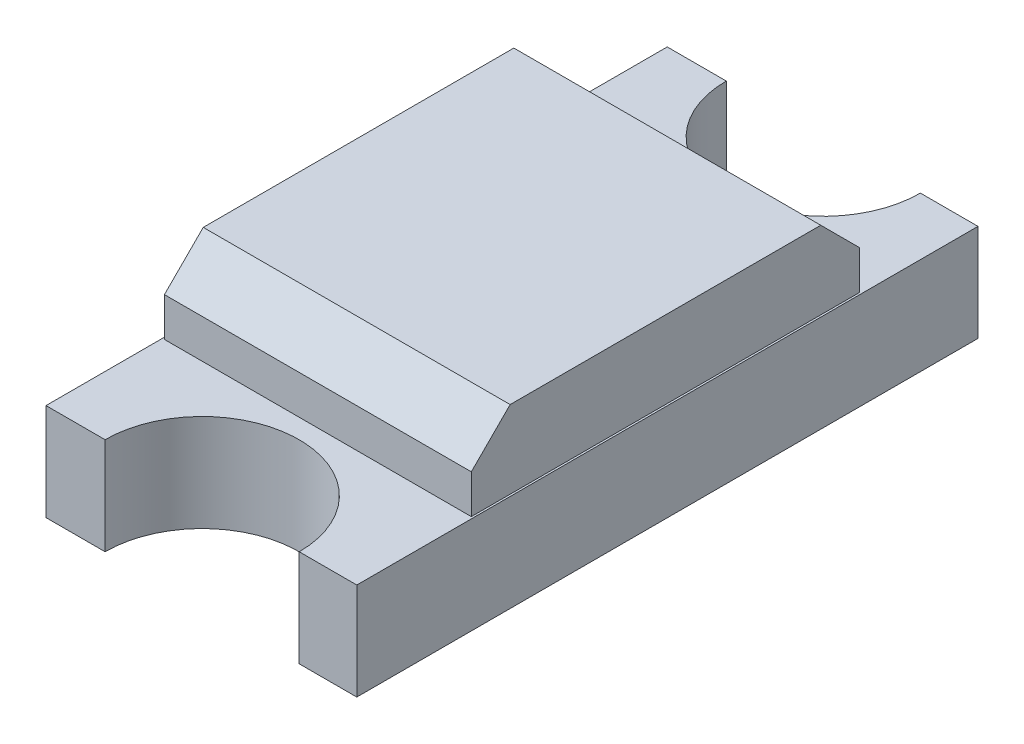
from build123d import *

# Parameters (mm, degrees)
BOSS_EXTRUDE1_DEPTH = 0.5
SKETCH2_W           = 1.580979229
SKETCH2_H           = 2
BOSS_EXTRUDE3_DEPTH = 0.4
CHAMFER2_SIZE       = 0.2


with BuildPart() as part:
    # Sketch1 → Boss-Extrude1 (new body)
    with BuildSketch(Plane(origin=(0, 0, 0), x_dir=(1, 0, 0), z_dir=(0, 1, 0))):
        with BuildLine():
            Line((-0.5, 0), (-0.804342602, 0))
            Line((-0.804342602, 0), (-0.804342602, -3.2))
            Line((-0.804342602, -3.2), (-0.5, -3.2))
            ThreePointArc((-0.5, -3.2), (0, -2.7), (0.5, -3.2))
            Line((0.5, -3.2), (0.796636627, -3.2))
            Line((0.796636627, -3.2), (0.796636627, 0))
            Line((0.796636627, 0), (0.5, 0))
            ThreePointArc((0.5, 0), (0, -0.5), (-0.5, 0))
        make_face()
    extrude(amount=BOSS_EXTRUDE1_DEPTH)

    # Sketch2 → Boss-Extrude3 (add)
    with BuildSketch(Plane(origin=(0, 0.5, 0), x_dir=(1, 0, 0), z_dir=(0, 1, 0))):
        with Locations((-0.003852988, -1.6)):
            Rectangle(SKETCH2_W, SKETCH2_H)
    extrude(amount=BOSS_EXTRUDE3_DEPTH)

    # Chamfer2
    chamfer2_edges = [part.edges().sort_by_distance(p)[0] for p in [
        (-0.003852988, 0.9, 2.6),
        (-0.003852988, 0.9, 0.6),
    ]]
    chamfer(chamfer2_edges, length=CHAMFER2_SIZE)


solid = part.part
